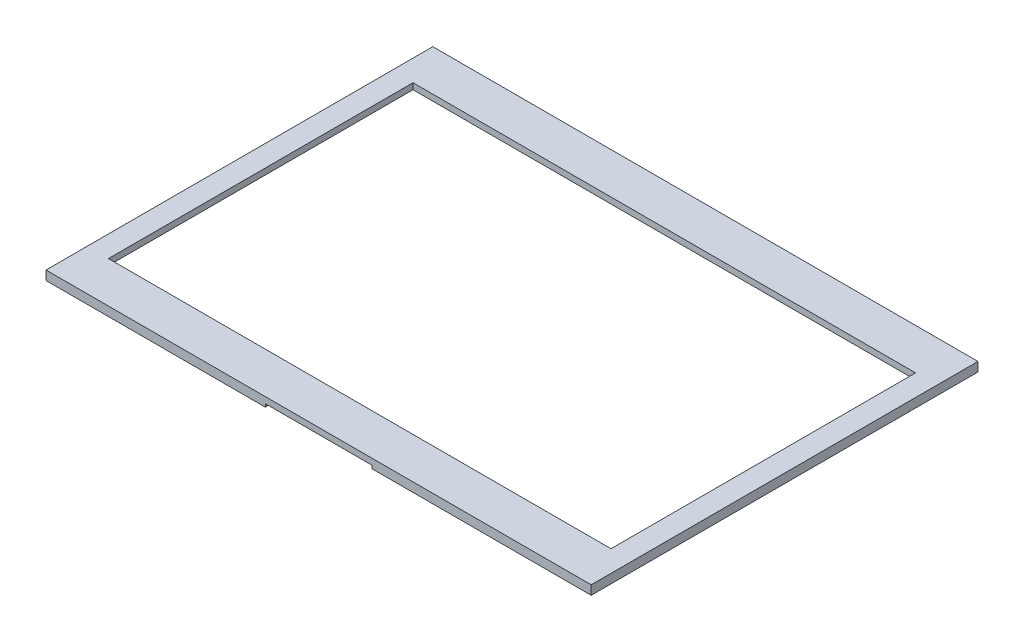
from build123d import *

# Parameters (mm, degrees)
SKETCH1_W           = 179
SKETCH1_H           = 127
SKETCH1_W_2         = 165
SKETCH1_H_2         = 100
BOSS_EXTRUDE1_DEPTH = 3
SKETCH1_3_W         = 172
SKETCH1_3_H         = 112
SKETCH1_3_W_2       = 35
SKETCH1_3_H_2       = 3.5
CUT_EXTRUDE1_DEPTH  = 1


with BuildPart() as part:
    # Sketch1 → Boss-Extrude1 (new body)
    with BuildSketch(Plane(origin=(0, 0, 0), x_dir=(1, 0, 0), z_dir=(0, 1, 0))):
        with Locations((89.5, 63.5)):
            Rectangle(SKETCH1_W, SKETCH1_H)
        with Locations((89.5, 63.5)):
            Rectangle(SKETCH1_W_2, SKETCH1_H_2, mode=Mode.SUBTRACT)
    extrude(amount=BOSS_EXTRUDE1_DEPTH)

    # Sketch1<3> → Cut-Extrude1 (cut)
    with BuildSketch(Plane(origin=(0, 0, 0), x_dir=(1, 0, 0), z_dir=(0, 1, 0))):
        with Locations((89.5, 59.5)):
            Rectangle(SKETCH1_3_W, SKETCH1_3_H)
        with Locations((89.5, 1.75)):
            Rectangle(SKETCH1_3_W_2, SKETCH1_3_H_2)
    extrude(amount=CUT_EXTRUDE1_DEPTH, mode=Mode.SUBTRACT)


solid = part.part
